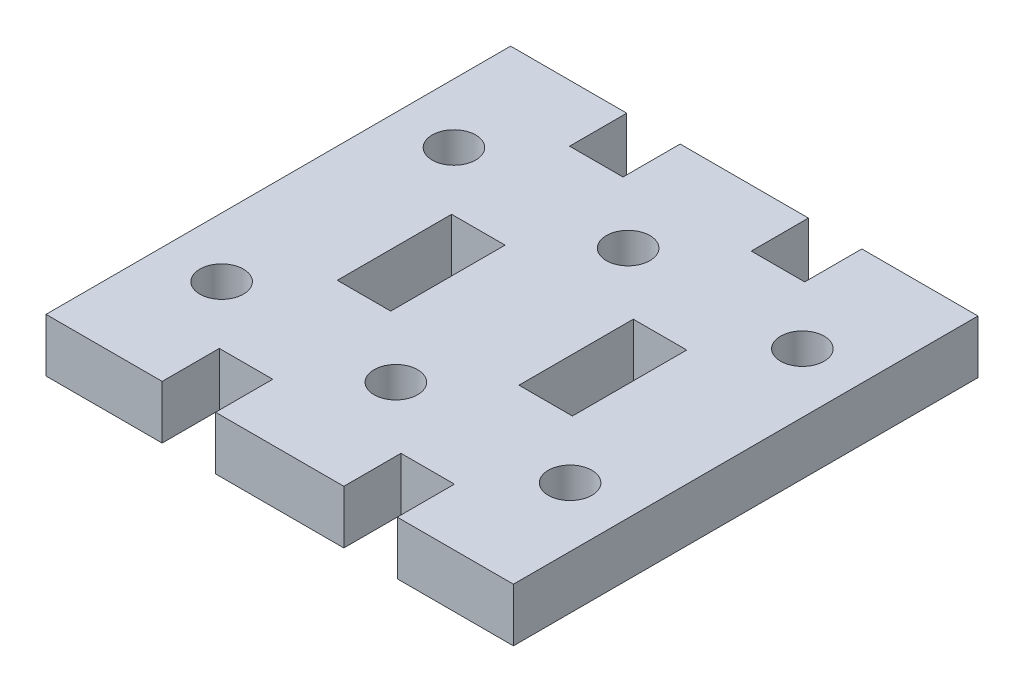
from build123d import *

# Parameters (mm, degrees)
SKETCH1_W           = 5.842
SKETCH1_H           = 12.5
BOSS_EXTRUDE1_DEPTH = 5.842
SKETCH2_R           = 2.38125
CUT_EXTRUDE1_DEPTH  = 37.500628488


with BuildPart() as part:
    # Sketch1 → Boss-Extrude1 (new body)
    with BuildSketch(Plane(origin=(0, 0, 0), x_dir=(1, 0, 0), z_dir=(0, 1, 0))):
        Polygon((7.012, -25.4), (-7.012, -25.4), (-7.012, -19.15), (-12.854, -19.15), (-12.854, -25.4), (-25.554, -25.4), (-25.554, 25.4), (-12.854, 25.4), (-12.854, 19.15), (-7.012, 19.15), (-7.012, 25.4), (7.012, 25.4), (7.012, 19.15), (12.854, 19.15), (12.854, 25.4), (25.554, 25.4), (25.554, -25.4), (12.854, -25.4), (12.854, -19.15), (7.012, -19.15), align=None)
        with Locations((-9.933, 0)):
            Rectangle(SKETCH1_W, SKETCH1_H, mode=Mode.SUBTRACT)
        with Locations((9.933, 0)):
            Rectangle(SKETCH1_W, SKETCH1_H, mode=Mode.SUBTRACT)
    extrude(amount=BOSS_EXTRUDE1_DEPTH)

    # Sketch2 → Cut-Extrude1 (cut, through all)
    with BuildSketch(Plane(origin=(0, 5.842, 0), x_dir=(1, 0, 0), z_dir=(0, 1, 0))):
        with Locations(Location((0, -12.7, 0), (0, 0, 270))):
            Circle(SKETCH2_R)
        with Locations(Location((0, 12.7, 0), (0, 0, 90))):
            Circle(SKETCH2_R)
        with Locations(Location((19.05, 12.7, 0), (0, 0, 270))):
            Circle(SKETCH2_R)
        with Locations(Location((19.05, -12.7, 0), (0, 0, 90))):
            Circle(SKETCH2_R)
        with Locations(Location((-19.05, 12.7, 0), (0, 0, 90))):
            Circle(SKETCH2_R)
        with Locations(Location((-19.05, -12.7, 0), (0, 0, 270))):
            Circle(SKETCH2_R)
    extrude(amount=-CUT_EXTRUDE1_DEPTH, mode=Mode.SUBTRACT)


solid = part.part
